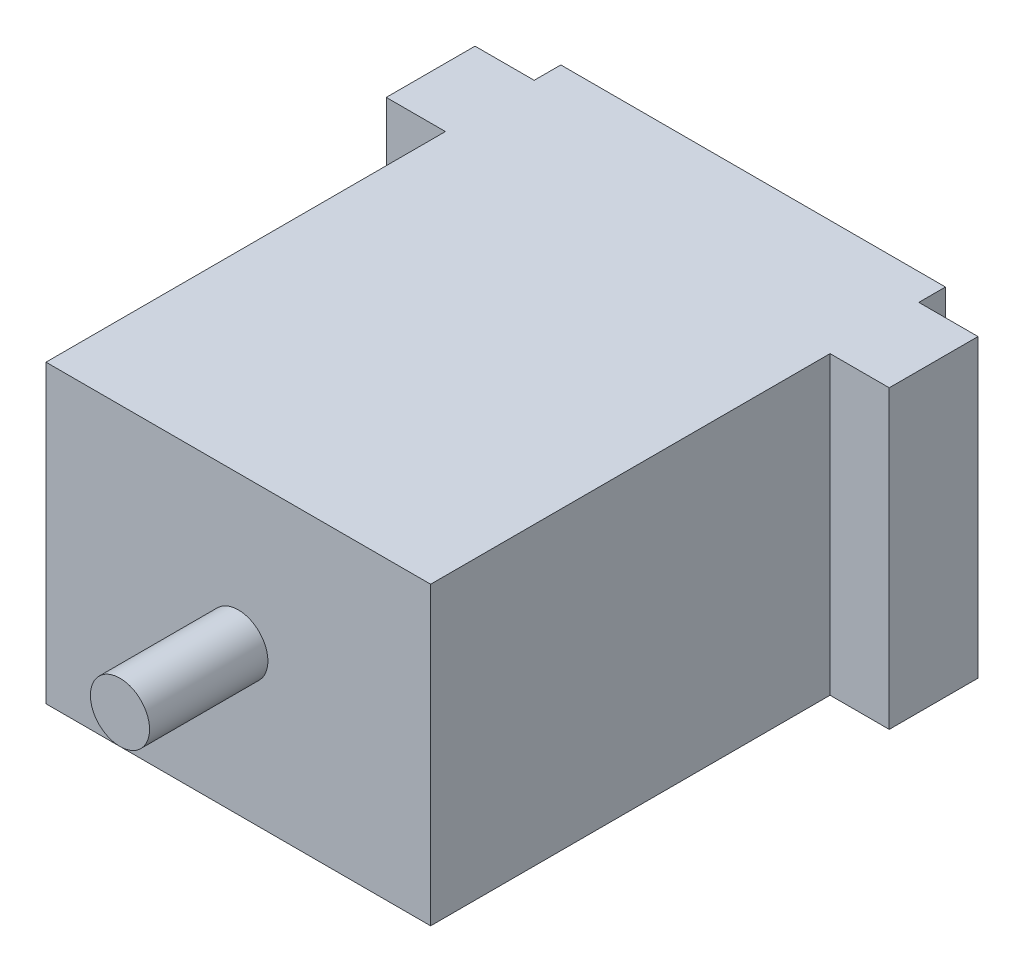
from build123d import *

# Parameters (mm, degrees)
SKETCH1_W           = 65
SKETCH1_H           = 50
BOSS_EXTRUDE1_DEPTH = 150
SKETCH2_W           = 15
SKETCH2_H           = 50
BOSS_EXTRUDE2_DEPTH = 10
SKETCH3_R           = 5
BOSS_EXTRUDE3_DEPTH = 20
SKETCH4_W           = 65
SKETCH4_H           = 63
CUT_EXTRUDE1_DEPTH  = 183.225821441


with BuildPart() as part:
    # Sketch1 → Boss-Extrude1 (new body)
    with BuildSketch(Plane.XY):
        Rectangle(SKETCH1_W, SKETCH1_H)
    extrude(amount=BOSS_EXTRUDE1_DEPTH)

    # Sketch2 → Boss-Extrude2 (add)
    with BuildSketch(Plane(origin=(32.5, 0, 0), x_dir=(0, 0, -1), z_dir=(1, 0, 0))):
        with Locations((-75, 0)):
            Rectangle(SKETCH2_W, SKETCH2_H)
    boss_extrude2 = extrude(amount=BOSS_EXTRUDE2_DEPTH)

    # Mirror1: Boss-Extrude2 across plane
    add(boss_extrude2.mirror(Plane(origin=(0, 0, 0), x_dir=(0, 0, 1), z_dir=(1, 0, 0))))

    # Sketch3 → Boss-Extrude3 (add)
    with BuildSketch(Plane.XY.offset(150)):
        Circle(SKETCH3_R)
    extrude(amount=BOSS_EXTRUDE3_DEPTH)

    # Sketch4 → Cut-Extrude1 (cut, through all)
    with BuildSketch(Plane(origin=(0, 25, 0), x_dir=(1, 0, 0), z_dir=(0, 1, 0))):
        with Locations((0, -31.5)):
            Rectangle(SKETCH4_W, SKETCH4_H)
    extrude(amount=-CUT_EXTRUDE1_DEPTH, mode=Mode.SUBTRACT)


solid = part.part
